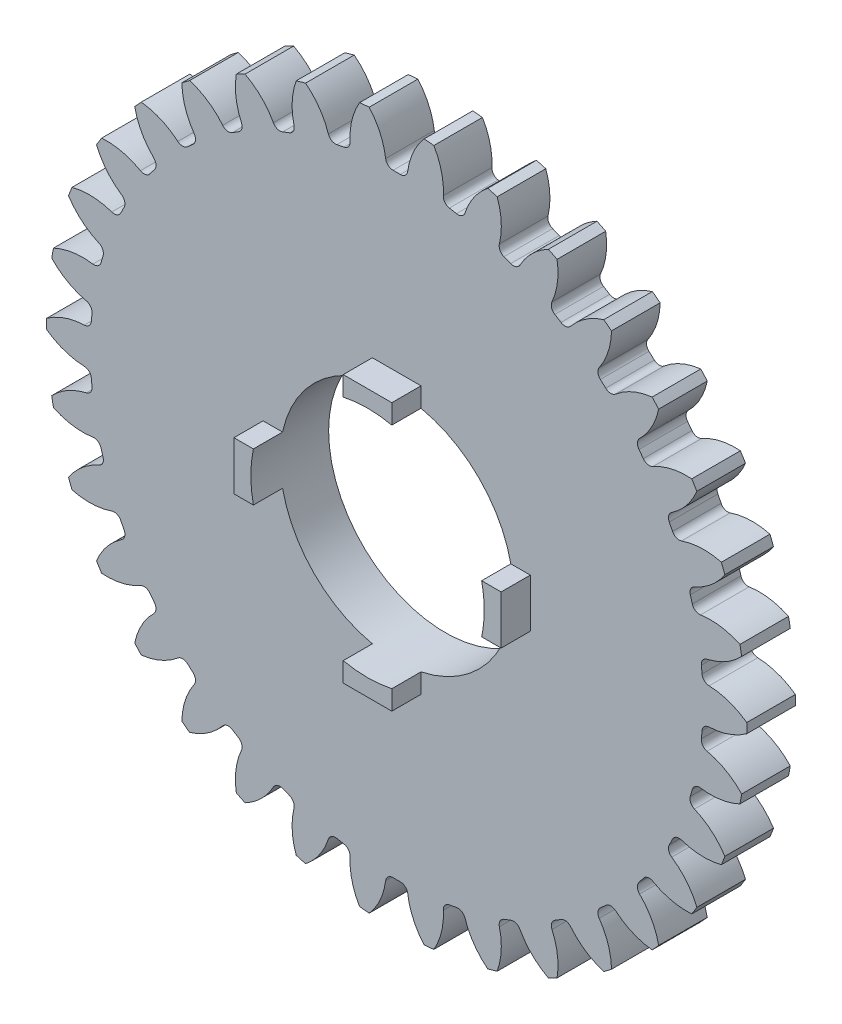
from build123d import *

# Parameters (mm, degrees)
SKETCH1_R                = 36
BOSS_EXTRUDE1_DEPTH      = 5
CUT_EXTRUDE1_DEPTH       = 10
FILLET2_R                = 0.76
CIRPATTERN2_COUNT        = 34
FILLET2_OF_CIRPATTERN2_R = 0.76
SKETCH2_R                = 12
CUT_EXTRUDE2_DEPTH       = 5
BOSS_EXTRUDE2_START      = 3
BOSS_EXTRUDE2_DEPTH      = 3


with BuildPart() as part:
    # Sketch1 → Boss-Extrude1 (new body)
    with BuildSketch(Plane.XY):
        Circle(SKETCH1_R)
    extrude(amount=-BOSS_EXTRUDE1_DEPTH)

    # Sketch1<4> → Cut-Extrude1 (cut)
    with BuildSketch(Plane.XY):
        with BuildLine():
            ThreePointArc((-1.078871134, 31.481518977), (0, 31.5), (1.078871134, 31.481518977))
            ThreePointArc((1.078871134, 31.481518977), (1.569884665, 33.836236421), (2.823485481, 35.889106004))
            ThreePointArc((2.823485481, 35.889106004), (0, 36), (-2.823485481, 35.889106004))
            ThreePointArc((-2.823485481, 35.889106004), (-1.569884665, 33.836236421), (-1.078871134, 31.481518977))
        make_face()
    cut_extrude1 = extrude(amount=-CUT_EXTRUDE1_DEPTH, mode=Mode.SUBTRACT)

    # Fillet2
    fillet2_edges = [part.edges().sort_by_distance(p)[0] for p in [
        (1.078871134, 31.481518977, -2.5),
        (-1.078871134, 31.481518977, -2.5),
    ]]
    fillet(fillet2_edges, radius=FILLET2_R)

    # CirPattern2: Cut-Extrude1 ×34 about axis
    cirpattern2_axis = Axis((0, 0, 0), (0, 0, 1))
    for i in range(1, CIRPATTERN2_COUNT):
        add(cut_extrude1.rotate(cirpattern2_axis, i * 360 / CIRPATTERN2_COUNT), mode=Mode.SUBTRACT)

    # Fillet2 of CirPattern2
    fillet2_of_cirpattern2_edges = [part.edges().sort_by_distance(p)[0] for p in [
        (-4.724212629, 31.143728342, -2.5),
        (-6.845215235, 30.74724424, -2.5),
        (-10.366418997, 29.745375391, -2.5),
        (-12.378453741, 28.965908979, -2.5),
        (-15.6556094, 27.334079357, -2.5),
        (-17.490158851, 26.198174428, -2.5),
        (-20.411666801, 23.991954035, -2.5),
        (-22.006257579, 22.538292468, -2.5),
        (-24.47262937, 19.832811492, -2.5),
        (-25.772959598, 18.11089599, -2.5),
        (-27.700205898, 14.998286342, -2.5),
        (-28.66199439, 13.06675467, -2.5),
        (-29.984485137, 9.653012538, -2.5),
        (-30.574979338, 7.577640692, -2.5),
        (-31.247678697, 3.97901697, -2.5),
        (-31.446770036, 1.830479249, -2.5),
        (-31.446770036, -1.830479249, -2.5),
        (-31.247678697, -3.97901697, -2.5),
        (-30.574979338, -7.577640692, -2.5),
        (-29.984485137, -9.653012538, -2.5),
        (-28.66199439, -13.06675467, -2.5),
        (-27.700205898, -14.998286342, -2.5),
        (-25.772959598, -18.11089599, -2.5),
        (-24.47262937, -19.832811492, -2.5),
        (-22.006257579, -22.538292468, -2.5),
        (-20.411666801, -23.991954035, -2.5),
        (-17.490158851, -26.198174428, -2.5),
        (-15.6556094, -27.334079357, -2.5),
        (-12.378453741, -28.965908979, -2.5),
        (-10.366418997, -29.745375391, -2.5),
        (-6.845215235, -30.74724424, -2.5),
        (-4.724212629, -31.143728342, -2.5),
        (-1.078871134, -31.481518977, -2.5),
        (1.078871134, -31.481518977, -2.5),
        (4.724212629, -31.143728342, -2.5),
        (6.845215235, -30.74724424, -2.5),
        (10.366418997, -29.745375391, -2.5),
        (12.378453741, -28.965908979, -2.5),
        (15.6556094, -27.334079357, -2.5),
        (17.490158851, -26.198174428, -2.5),
        (20.411666801, -23.991954035, -2.5),
        (22.006257579, -22.538292468, -2.5),
        (24.47262937, -19.832811492, -2.5),
        (25.772959598, -18.11089599, -2.5),
        (27.700205898, -14.998286342, -2.5),
        (28.66199439, -13.06675467, -2.5),
        (29.984485137, -9.653012538, -2.5),
        (30.574979338, -7.577640692, -2.5),
        (31.247678697, -3.97901697, -2.5),
        (31.446770036, -1.830479249, -2.5),
        (31.446770036, 1.830479249, -2.5),
        (31.247678697, 3.97901697, -2.5),
        (30.574979338, 7.577640692, -2.5),
        (29.984485137, 9.653012538, -2.5),
        (28.66199439, 13.06675467, -2.5),
        (27.700205898, 14.998286342, -2.5),
        (25.772959598, 18.11089599, -2.5),
        (24.47262937, 19.832811492, -2.5),
        (22.006257579, 22.538292468, -2.5),
        (20.411666801, 23.991954035, -2.5),
        (17.490158851, 26.198174428, -2.5),
        (15.6556094, 27.334079357, -2.5),
        (12.378453741, 28.965908979, -2.5),
        (10.366418997, 29.745375391, -2.5),
        (6.845215235, 30.74724424, -2.5),
        (4.724212629, 31.143728342, -2.5),
    ]]
    fillet(fillet2_of_cirpattern2_edges, radius=FILLET2_OF_CIRPATTERN2_R)

    # Sketch2 → Cut-Extrude2 (cut)
    with BuildSketch(Plane.XY):
        Circle(SKETCH2_R)
    extrude(amount=-CUT_EXTRUDE2_DEPTH, mode=Mode.SUBTRACT)

    # Sketch3 → Boss-Extrude2 (add)
    with BuildSketch(Plane.XY.offset(BOSS_EXTRUDE2_START)):
        with BuildLine():
            Line((-2.5, 11.736694594), (-2.5, 13.736694594))
            Line((-2.5, 13.736694594), (2.5, 13.736694594))
            Line((2.5, 13.736694594), (2.5, 11.736694594))
            ThreePointArc((2.5, 11.736694594), (0, 12), (-2.5, 11.736694594))
        make_face()
        with BuildLine():
            Line((13.736694594, -2.5), (11.736694594, -2.5))
            ThreePointArc((11.736694594, -2.5), (12, 0), (11.736694594, 2.5))
            Line((11.736694594, 2.5), (13.736694594, 2.5))
            Line((13.736694594, 2.5), (13.736694594, -2.5))
        make_face()
        with BuildLine():
            Line((-2.5, -13.736694594), (-2.5, -11.736694594))
            ThreePointArc((-2.5, -11.736694594), (0, -12), (2.5, -11.736694594))
            Line((2.5, -11.736694594), (2.5, -13.736694594))
            Line((2.5, -13.736694594), (-2.5, -13.736694594))
        make_face()
        with BuildLine():
            Line((-13.736694594, 2.5), (-11.736694594, 2.5))
            ThreePointArc((-11.736694594, 2.5), (-12, 0), (-11.736694594, -2.5))
            Line((-11.736694594, -2.5), (-13.736694594, -2.5))
            Line((-13.736694594, -2.5), (-13.736694594, 2.5))
        make_face()
    extrude(amount=-BOSS_EXTRUDE2_DEPTH)


solid = part.part
